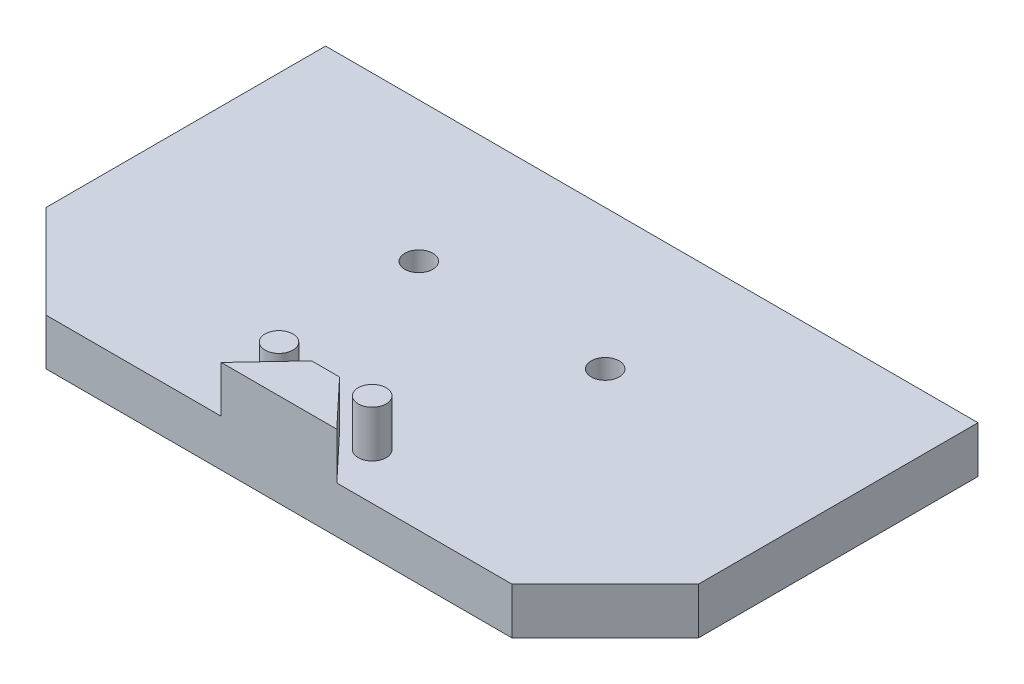
from build123d import *

# Parameters (mm, degrees)
SKETCH1_W           = 70
SKETCH1_H           = 40
BOSS_EXTRUDE1_DEPTH = 5
SKETCH2_R           = 1.5
CUT_EXTRUDE1_DEPTH  = 5
SKETCH2_3_R         = 1.5
CUT_EXTRUDE2_DEPTH  = 5
SKETCH3_R           = 1.5
BOSS_EXTRUDE2_DEPTH = 5
SKETCH3_3_R         = 1.5
BOSS_EXTRUDE3_DEPTH = 5
CUT_EXTRUDE3_DEPTH  = 10
CUT_EXTRUDE4_DEPTH  = 10
BOSS_EXTRUDE4_DEPTH = 5


with BuildPart() as part:
    # Sketch1 → Boss-Extrude1 (new body)
    with BuildSketch(Plane(origin=(0, 0, 0), x_dir=(1, 0, 0), z_dir=(0, 1, 0))):
        Rectangle(SKETCH1_W, SKETCH1_H)
    extrude(amount=BOSS_EXTRUDE1_DEPTH)

    # Sketch2 → Cut-Extrude1 (cut)
    with BuildSketch(Plane(origin=(0, 5, 0), x_dir=(1, 0, 0), z_dir=(0, 1, 0))):
        with Locations((-10, 5)):
            Circle(SKETCH2_R)
    extrude(amount=-CUT_EXTRUDE1_DEPTH, mode=Mode.SUBTRACT)

    # Sketch2<3> → Cut-Extrude2 (cut)
    with BuildSketch(Plane(origin=(0, 5, 0), x_dir=(1, 0, 0), z_dir=(0, 1, 0))):
        with Locations((-10, 5)):
            Circle(SKETCH2_3_R)
        with Locations((10, 5)):
            Circle(SKETCH2_3_R)
    extrude(amount=-CUT_EXTRUDE2_DEPTH, mode=Mode.SUBTRACT)

    # Sketch3 → Boss-Extrude2 (add)
    with BuildSketch(Plane(origin=(0, 5, 0), x_dir=(1, 0, 0), z_dir=(0, 1, 0))):
        with Locations((-5, -15)):
            Circle(SKETCH3_R)
    extrude(amount=BOSS_EXTRUDE2_DEPTH)

    # Sketch3<3> → Boss-Extrude3 (add)
    with BuildSketch(Plane(origin=(0, 5, 0), x_dir=(1, 0, 0), z_dir=(0, 1, 0))):
        with Locations((-5, -15)):
            Circle(SKETCH3_3_R)
        with Locations((5, -15)):
            Circle(SKETCH3_3_R)
    extrude(amount=BOSS_EXTRUDE3_DEPTH)

    # Sketch8 → Cut-Extrude3 (cut)
    with BuildSketch(Plane(origin=(0, 5, 0), x_dir=(1, 0, 0), z_dir=(0, 1, 0))):
        Polygon((-25, -20), (-35, -10), (-35, -20), align=None)
    extrude(amount=-CUT_EXTRUDE3_DEPTH, mode=Mode.SUBTRACT)

    # Sketch9 → Cut-Extrude4 (cut)
    with BuildSketch(Plane(origin=(0, 5, 0), x_dir=(1, 0, 0), z_dir=(0, 1, 0))):
        Polygon((35, -20), (25, -20), (35, -10), align=None)
    extrude(amount=-CUT_EXTRUDE4_DEPTH, mode=Mode.SUBTRACT)

    # Sketch13 → Boss-Extrude4 (add)
    with BuildSketch(Plane(origin=(0, 5, 0), x_dir=(1, 0, 0), z_dir=(0, 1, 0))):
        Polygon((-6.2, -20), (6.2, -20), (1.5, -15), (-1.5, -15), align=None)
    extrude(amount=BOSS_EXTRUDE4_DEPTH)


solid = part.part
